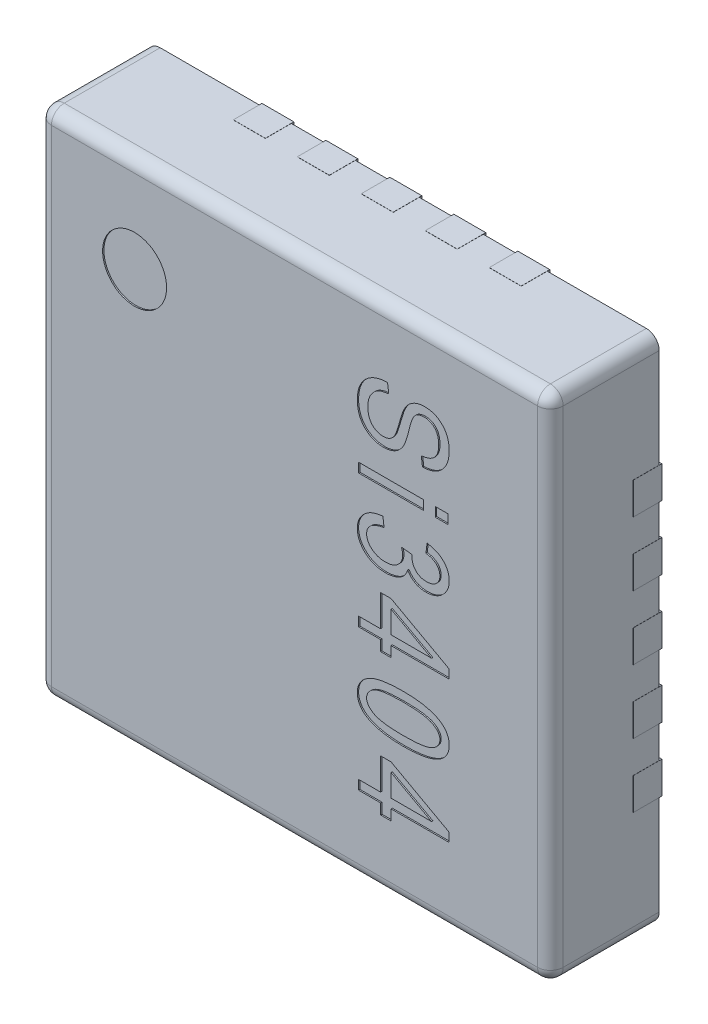
from build123d import *

# Parameters (mm, degrees)
SKETCH1_W                   = 4
SKETCH1_H                   = 4
BOSS_EXTRUDE1_DEPTH         = 0.85
FILLET1_R                   = 0.1
BOSS_EXTRUDE2_DEPTH         = 0.02
BOSS_EXTRUDE2_DEPTH_BACK    = 0.203
BOSS_EXTRUDE2_2_DEPTH       = 0.02
BOSS_EXTRUDE2_2_DEPTH_BACK  = 0.203
BOSS_EXTRUDE2_3_DEPTH       = 0.02
BOSS_EXTRUDE2_3_DEPTH_BACK  = 0.203
BOSS_EXTRUDE2_4_DEPTH       = 0.02
BOSS_EXTRUDE2_4_DEPTH_BACK  = 0.203
BOSS_EXTRUDE2_5_DEPTH       = 0.02
BOSS_EXTRUDE2_5_DEPTH_BACK  = 0.203
BOSS_EXTRUDE2_6_DEPTH       = 0.02
BOSS_EXTRUDE2_6_DEPTH_BACK  = 0.203
BOSS_EXTRUDE2_7_DEPTH       = 0.02
BOSS_EXTRUDE2_7_DEPTH_BACK  = 0.203
BOSS_EXTRUDE2_8_DEPTH       = 0.02
BOSS_EXTRUDE2_8_DEPTH_BACK  = 0.203
BOSS_EXTRUDE2_9_DEPTH       = 0.02
BOSS_EXTRUDE2_9_DEPTH_BACK  = 0.203
BOSS_EXTRUDE2_10_DEPTH      = 0.02
BOSS_EXTRUDE2_10_DEPTH_BACK = 0.203
BOSS_EXTRUDE2_11_DEPTH      = 0.02
BOSS_EXTRUDE2_11_DEPTH_BACK = 0.203
BOSS_EXTRUDE2_12_DEPTH      = 0.02
BOSS_EXTRUDE2_12_DEPTH_BACK = 0.203
BOSS_EXTRUDE2_13_DEPTH      = 0.02
BOSS_EXTRUDE2_13_DEPTH_BACK = 0.203
BOSS_EXTRUDE2_14_DEPTH      = 0.02
BOSS_EXTRUDE2_14_DEPTH_BACK = 0.203
BOSS_EXTRUDE2_15_DEPTH      = 0.02
BOSS_EXTRUDE2_15_DEPTH_BACK = 0.203
BOSS_EXTRUDE2_16_DEPTH      = 0.02
BOSS_EXTRUDE2_16_DEPTH_BACK = 0.203
BOSS_EXTRUDE2_17_DEPTH      = 0.02
BOSS_EXTRUDE2_17_DEPTH_BACK = 0.203
BOSS_EXTRUDE2_18_DEPTH      = 0.02
BOSS_EXTRUDE2_18_DEPTH_BACK = 0.203
BOSS_EXTRUDE2_19_DEPTH      = 0.02
BOSS_EXTRUDE2_19_DEPTH_BACK = 0.203
BOSS_EXTRUDE2_20_DEPTH      = 0.02
BOSS_EXTRUDE2_20_DEPTH_BACK = 0.203
BOSS_EXTRUDE2_21_DEPTH      = 0.02
BOSS_EXTRUDE2_21_DEPTH_BACK = 0.203
SKETCH3_R                   = 0.25
SKETCH3_W                   = 0.1
SKETCH3_H                   = 0.072727273
SKETCH3_W_2                 = 0.509090909
CUT_EXTRUDE1_DEPTH          = 0.01


with BuildPart() as part:
    # Sketch1 → Boss-Extrude1 (new body)
    with BuildSketch(Plane.XY):
        Rectangle(SKETCH1_W, SKETCH1_H)
    extrude(amount=BOSS_EXTRUDE1_DEPTH)

    # Fillet1
    fillet1_edges = [part.edges().sort_by_distance(p)[0] for p in [
        (2, 0, 0.85),
        (0, 2, 0.85),
        (-2, 0, 0.85),
        (-2, 2, 0.425),
        (2, 2, 0.425),
        (2, -2, 0.425),
        (-2, -2, 0.425),
        (0, -2, 0.85),
    ]]
    fillet(fillet1_edges, radius=FILLET1_R)

    # Sketch3 → Cut-Extrude1 (cut)
    # profile 1 of 8: a face of its own
    with BuildSketch(Plane.XY.offset(0.85)):
        with Locations((-1.25, 1.25)):
            Circle(SKETCH3_R)
    # profile 2 of 8: a face of its own
    with BuildSketch(Plane.XY.offset(0.85)):
        with BuildLine():
            Line((0.727272727, 1.472727273), (0.736363636, 1.4))
            add(Edge.make_bspline(
                [(0.736363636, 1.4), (0.727103806, 1.398942924), (0.709542466, 1.396938172), (0.684965563, 1.39141401), (0.663537943, 1.384126891), (0.645117837, 1.374788123), (0.629182151, 1.363372064), (0.615185549, 1.3498771), (0.602770645, 1.33423415), (0.591999182, 1.316678555), (0.583328643, 1.297412467), (0.577262693, 1.276760749), (0.573442789, 1.254970538), (0.572969302, 1.240025654), (0.572727273, 1.232386364)],
                knots=[0, 0, 0, 0, 1.280838358, 2.42911977, 3.45660717, 4.385483972, 5.258147535, 6.142272574, 7.050287598, 7.997198138, 8.967654339, 9.946114797, 10.950127382, 12, 12, 12, 12], degree=3))
            add(Edge.make_bspline(
                [(0.572727273, 1.232386364), (0.572837876, 1.226936735), (0.573052824, 1.216345826), (0.574673566, 1.200925091), (0.577105198, 1.186397183), (0.580934854, 1.172870183), (0.585305433, 1.160087678), (0.591259059, 1.148483936), (0.597935921, 1.137650827), (0.605728675, 1.127891958), (0.614419491, 1.11925579), (0.623697414, 1.111613117), (0.633690607, 1.105242101), (0.644221941, 1.099897755), (0.655475493, 1.095968576), (0.667240372, 1.092923818), (0.6797328, 1.091225755), (0.688252727, 1.0910163), (0.692613636, 1.090909091)],
                knots=[0, 0, 0, 0, 1.249746026, 2.428779581, 3.553697291, 4.62341608, 5.650607881, 6.646311833, 7.607599024, 8.56593672, 9.502864691, 10.4137476, 11.31754536, 12.216107463, 13.116177936, 14.046028929, 14.999863452, 16, 16, 16, 16], degree=3))
            add(Edge.make_bspline(
                [(0.692613636, 1.090909091), (0.697644535, 1.091061324), (0.707443503, 1.091357838), (0.721672501, 1.094004325), (0.734938598, 1.098209522), (0.747232571, 1.104246537), (0.758373301, 1.112183328), (0.768556469, 1.121755306), (0.777503341, 1.13317042), (0.784297687, 1.144047791), (0.789244318, 1.154559109), (0.793508689, 1.164489352), (0.798006744, 1.176448745), (0.802848127, 1.190417651), (0.807891789, 1.206400583), (0.813295911, 1.224406318), (0.819131335, 1.24437193), (0.822985269, 1.258422036), (0.825, 1.265767045)],
                knots=[0, 0, 0, 0, 1.005084549, 1.957660522, 2.882744275, 3.780292509, 4.683811859, 5.607974817, 6.5645409, 7.576069362, 8.164610543, 8.885578733, 9.73653607, 10.718528732, 11.841250066, 13.087129597, 14.477231467, 16, 16, 16, 16], degree=3))
            add(Edge.make_bspline(
                [(0.825, 1.265767045), (0.826860579, 1.272358405), (0.830446203, 1.285060972), (0.83617238, 1.303281471), (0.84178798, 1.320090385), (0.847619541, 1.335373731), (0.853368751, 1.349221368), (0.859379792, 1.361461672), (0.865313704, 1.372294413), (0.873175433, 1.384757779), (0.884183484, 1.398357259), (0.898826692, 1.412806622), (0.915198528, 1.425231004), (0.932987678, 1.435786634), (0.952232074, 1.444248055), (0.972880055, 1.450128526), (0.994693444, 1.454005862), (1.009689303, 1.454363329), (1.017329545, 1.454545455)],
                knots=[0, 0, 0, 0, 1.113986453, 2.146823571, 3.106424162, 3.996133152, 4.807195916, 5.544312915, 6.213079188, 6.815589384, 7.939013873, 9.050041172, 10.154508942, 11.273277387, 12.407970945, 13.56323151, 14.75849049, 16, 16, 16, 16], degree=3))
            add(Edge.make_bspline(
                [(1.017329545, 1.454545455), (1.024203666, 1.454388685), (1.037716801, 1.454080509), (1.057495016, 1.451449671), (1.076379214, 1.447279602), (1.0941677, 1.441057033), (1.111113818, 1.433444004), (1.126877432, 1.423802854), (1.141836305, 1.412654461), (1.155634887, 1.39974719), (1.168289632, 1.385530874), (1.179166448, 1.369842884), (1.188383474, 1.353014385), (1.196171029, 1.335041859), (1.201929476, 1.315760075), (1.205982817, 1.295352318), (1.2086464, 1.273791341), (1.208940216, 1.259004412), (1.209090909, 1.251420455)],
                knots=[0, 0, 0, 0, 1.048547399, 2.061232895, 3.039277619, 3.994368589, 4.931972946, 5.868741773, 6.808014961, 7.774272834, 8.746911737, 9.706990873, 10.680354074, 11.670809819, 12.690200298, 13.744432806, 14.843158913, 16, 16, 16, 16], degree=3))
            add(Edge.make_bspline(
                [(1.209090909, 1.251420455), (1.208802256, 1.241081), (1.208239018, 1.220906006), (1.203528429, 1.191640842), (1.195548121, 1.164387313), (1.184443342, 1.13924919), (1.170424466, 1.11642215), (1.153405846, 1.096299839), (1.133770421, 1.078738947), (1.111298043, 1.064152879), (1.086549759, 1.052265388), (1.059482045, 1.04389351), (1.030501444, 1.037956182), (1.010352719, 1.036904174), (1, 1.036363636)],
                knots=[0, 0, 0, 0, 1.103031712, 2.152304697, 3.153276159, 4.12609515, 5.076890607, 6.002136676, 6.929161205, 7.878034381, 8.852230514, 9.849470333, 10.895025311, 12, 12, 12, 12], degree=3))
            Line((1, 1.036363636), (0.990909091, 1.109090909))
            add(Edge.make_bspline(
                [(0.990909091, 1.109090909), (0.996506992, 1.109624065), (1.007423331, 1.110663761), (1.023124332, 1.113543253), (1.037773373, 1.117200429), (1.051226903, 1.121858913), (1.063610083, 1.12743429), (1.074823493, 1.133921291), (1.084918376, 1.141413119), (1.093882762, 1.149796571), (1.101795678, 1.159141799), (1.108591038, 1.169422163), (1.114476462, 1.180527397), (1.119117201, 1.192567714), (1.122861262, 1.205385125), (1.12534886, 1.219145774), (1.126938796, 1.233769534), (1.127159518, 1.24384034), (1.127272727, 1.249005682)],
                knots=[0, 0, 0, 0, 1.224838824, 2.388530277, 3.474573471, 4.512194328, 5.48648064, 6.429677658, 7.329378801, 8.219922745, 9.098431758, 9.991243998, 10.900419967, 11.831576646, 12.798129317, 13.805876065, 14.874628406, 16, 16, 16, 16], degree=3))
            add(Edge.make_bspline(
                [(1.127272727, 1.249005682), (1.127226084, 1.254266579), (1.127135928, 1.264435176), (1.125444538, 1.279184235), (1.123103586, 1.293016436), (1.11976564, 1.30593346), (1.115255117, 1.317815769), (1.110101268, 1.328881082), (1.103622453, 1.338808311), (1.096375843, 1.347845145), (1.08823977, 1.355757859), (1.079608307, 1.36274349), (1.070373617, 1.368660568), (1.060573076, 1.373513985), (1.050107793, 1.377177285), (1.039133042, 1.379918542), (1.027553436, 1.381467301), (1.019654026, 1.381699666), (1.015625, 1.381818182)],
                knots=[0, 0, 0, 0, 1.287208177, 2.487998315, 3.629583546, 4.720547933, 5.747622748, 6.737928225, 7.702594599, 8.642209589, 9.568501139, 10.475514979, 11.356601253, 12.248299753, 13.14660463, 14.065979384, 15.013569424, 16, 16, 16, 16], degree=3))
            add(Edge.make_bspline(
                [(1.015625, 1.381818182), (1.008402688, 1.381577201), (0.994669797, 1.381118986), (0.975324079, 1.376835154), (0.958367383, 1.369704713), (0.949112206, 1.362472858), (0.944602273, 1.358948864)],
                knots=[0, 0, 0, 0, 1.135097977, 2.158336086, 3.102579849, 4, 4, 4, 4], degree=3))
            add(Edge.make_bspline(
                [(0.944602273, 1.358948864), (0.942444624, 1.356785118), (0.937758322, 1.352085575), (0.931854076, 1.343034415), (0.925642614, 1.332260427), (0.920009033, 1.319203801), (0.914102065, 1.304340388), (0.908686505, 1.287294909), (0.90308319, 1.268283554), (0.899755702, 1.254797134), (0.898011364, 1.247727273)],
                knots=[0, 0, 0, 0, 0.600125557, 1.303441474, 2.117395318, 3.047759802, 4.098473224, 5.265768101, 6.566659033, 8, 8, 8, 8], degree=3))
            add(Edge.make_bspline(
                [(0.898011364, 1.247727273), (0.896331382, 1.240760861), (0.8931033, 1.22737491), (0.88805872, 1.208181265), (0.883442127, 1.190582405), (0.878896137, 1.174560658), (0.874367883, 1.160185683), (0.870057674, 1.147371638), (0.866242523, 1.136092542), (0.863298459, 1.129292811), (0.861931818, 1.126136364)],
                knots=[0, 0, 0, 0, 1.354602698, 2.602867115, 3.751358272, 4.793927027, 5.750750683, 6.599868674, 7.350056397, 8, 8, 8, 8], degree=3))
            add(Edge.make_bspline(
                [(0.861931818, 1.126136364), (0.857794116, 1.11768145), (0.849737463, 1.101218618), (0.834281395, 1.079105556), (0.816284253, 1.060415276), (0.796132303, 1.044889628), (0.773672126, 1.032819649), (0.749121081, 1.024326376), (0.722569969, 1.019082478), (0.704191573, 1.018487607), (0.694744318, 1.018181818)],
                knots=[0, 0, 0, 0, 1.065654875, 2.074970594, 3.042706323, 3.995751283, 4.946482197, 5.918907631, 6.930232564, 8, 8, 8, 8], degree=3))
            add(Edge.make_bspline(
                [(0.694744318, 1.018181818), (0.685250511, 1.018491935), (0.666491623, 1.019104699), (0.639041754, 1.024505651), (0.612945604, 1.033414689), (0.588377235, 1.04555853), (0.566016439, 1.060935426), (0.546002634, 1.078726398), (0.529084761, 1.09933212), (0.515104263, 1.122387409), (0.504014348, 1.147919092), (0.496540716, 1.176029999), (0.491702396, 1.206509198), (0.491179657, 1.227679024), (0.490909091, 1.238636364)],
                knots=[0, 0, 0, 0, 1.011232613, 1.998102583, 2.968509142, 3.943590051, 4.909523818, 5.853018554, 6.788746208, 7.740024944, 8.71886049, 9.744946948, 10.832801918, 12, 12, 12, 12], degree=3))
            add(Edge.make_bspline(
                [(0.490909091, 1.238636364), (0.491090569, 1.247262596), (0.4914447, 1.264095561), (0.494475914, 1.288630632), (0.49945995, 1.31183118), (0.506331363, 1.333720101), (0.515422896, 1.354247791), (0.52633162, 1.373488906), (0.539345312, 1.391353972), (0.554307753, 1.407684438), (0.570914055, 1.422445694), (0.58901038, 1.435475574), (0.608703269, 1.446421701), (0.629629785, 1.455701381), (0.652108127, 1.462753199), (0.675840059, 1.468189337), (0.701091851, 1.47159385), (0.718408483, 1.472343522), (0.727272727, 1.472727273)],
                knots=[0, 0, 0, 0, 1.104941531, 2.156148984, 3.161617203, 4.142029089, 5.090015186, 6.032862687, 6.970857379, 7.915576694, 8.8652501, 9.813080891, 10.76648675, 11.747123846, 12.740939458, 13.779962465, 14.863580683, 16, 16, 16, 16], degree=3))
        make_face()
    # profile 3 of 8: a face of its own
    with BuildSketch(Plane.XY.offset(0.85)):
        with Locations((1.15, 0.783636364)):
            Rectangle(SKETCH3_W, SKETCH3_H)
    # profile 4 of 8: a face of its own
    with BuildSketch(Plane.XY.offset(0.85)):
        with Locations((0.754545454, 0.783636364)):
            Rectangle(SKETCH3_W_2, SKETCH3_H)
    # profile 5 of 8: a face of its own
    with BuildSketch(Plane.XY.offset(0.85)):
        with BuildLine():
            Line((0.690909091, 0.549090909), (0.7, 0.476363636))
            add(Edge.make_bspline(
                [(0.7, 0.476363636), (0.694496447, 0.475425654), (0.683772037, 0.473597868), (0.668339154, 0.470001597), (0.653897987, 0.466076607), (0.640584485, 0.461527455), (0.628268604, 0.456568748), (0.617028874, 0.451069876), (0.606867177, 0.444921933), (0.597777622, 0.438276249), (0.589717165, 0.431112297), (0.582738606, 0.423462665), (0.576846937, 0.415255713), (0.571943811, 0.406569672), (0.568306467, 0.397267088), (0.565530449, 0.387530742), (0.563986474, 0.377217575), (0.563754763, 0.370165795), (0.563636364, 0.3665625)],
                knots=[0, 0, 0, 0, 1.392235382, 2.712957193, 3.95076201, 5.123471921, 6.220028287, 7.260520794, 8.240826993, 9.178593426, 10.065213643, 10.926376853, 11.755607984, 12.580369742, 13.407158359, 14.241002189, 15.101193065, 16, 16, 16, 16], degree=3))
            add(Edge.make_bspline(
                [(0.563636364, 0.3665625), (0.563711161, 0.362621302), (0.563858176, 0.354874811), (0.56605663, 0.343524847), (0.569043998, 0.332489868), (0.573768787, 0.32196), (0.579362749, 0.311681696), (0.586480905, 0.301903465), (0.594881855, 0.292609707), (0.604305986, 0.283673975), (0.614831196, 0.275597424), (0.626184798, 0.268479206), (0.63838825, 0.262489276), (0.651268652, 0.257539143), (0.664906815, 0.253657817), (0.679269095, 0.250999418), (0.69442538, 0.249432784), (0.704778432, 0.249206763), (0.710085227, 0.249090909)],
                knots=[0, 0, 0, 0, 0.903873886, 1.776579465, 2.647656607, 3.524622446, 4.420541798, 5.332235935, 6.29517969, 7.295547799, 8.311582909, 9.337756895, 10.369048988, 11.429583737, 12.503863447, 13.621753468, 14.780951969, 16, 16, 16, 16], degree=3))
            add(Edge.make_bspline(
                [(0.710085227, 0.249090909), (0.715059778, 0.24921972), (0.724745068, 0.24947051), (0.738911993, 0.250849894), (0.752333767, 0.253377255), (0.764973724, 0.25715351), (0.777026588, 0.261625291), (0.788246195, 0.267333195), (0.798697065, 0.274068739), (0.808303906, 0.281689386), (0.816965072, 0.290101324), (0.824663003, 0.298978616), (0.831123294, 0.30847327), (0.836393044, 0.318374065), (0.84038126, 0.328797836), (0.843422805, 0.339570243), (0.845135603, 0.350930042), (0.845346853, 0.358649804), (0.845454545, 0.362585227)],
                knots=[0, 0, 0, 0, 1.20855087, 2.353009927, 3.453810045, 4.520244562, 5.554115699, 6.572581516, 7.571175158, 8.569901267, 9.54598548, 10.500346522, 11.419112918, 12.329780476, 13.2183167, 14.125199497, 15.044253818, 16, 16, 16, 16], degree=3))
            add(Edge.make_bspline(
                [(0.845454545, 0.362585227), (0.845342557, 0.366143633), (0.84510383, 0.373729176), (0.843039294, 0.385673693), (0.840137612, 0.398892547), (0.837290224, 0.407964726), (0.835795455, 0.412727273)],
                knots=[0, 0, 0, 0, 0.832645691, 1.774971563, 2.831945141, 4, 4, 4, 4], degree=3))
            Line((0.835795455, 0.412727273), (0.918181818, 0.403636364))
            Line((0.918181818, 0.403636364), (0.9171875, 0.392698864))
            add(Edge.make_bspline(
                [(0.9171875, 0.392698864), (0.917235164, 0.388478025), (0.917328173, 0.380241741), (0.919057124, 0.36819763), (0.921333634, 0.356702359), (0.924854559, 0.345858881), (0.928994, 0.335516706), (0.934580986, 0.325992241), (0.940734723, 0.316839029), (0.948011564, 0.308479316), (0.95609207, 0.300937143), (0.964933076, 0.294403563), (0.97435578, 0.288830586), (0.984392716, 0.28423291), (0.995113871, 0.280695991), (1.006476653, 0.278117888), (1.018527392, 0.276746863), (1.026748786, 0.276493565), (1.030965909, 0.276363636)],
                knots=[0, 0, 0, 0, 1.10423394, 2.154733732, 3.181022991, 4.16930239, 5.136508654, 6.091636863, 7.054700897, 8.021748173, 8.986885544, 9.944184593, 10.894794516, 11.849198014, 12.829510438, 13.846317023, 14.895278801, 16, 16, 16, 16], degree=3))
            add(Edge.make_bspline(
                [(1.030965909, 0.276363636), (1.038519893, 0.276689599), (1.053037298, 0.277316041), (1.073714316, 0.282124701), (1.092016699, 0.290504008), (1.107664797, 0.302039188), (1.120274673, 0.315920296), (1.129724418, 0.331427137), (1.135323413, 0.348624699), (1.13601263, 0.360603788), (1.136363636, 0.366704545)],
                knots=[0, 0, 0, 0, 1.168747258, 2.246123166, 3.262822778, 4.26410748, 5.234436762, 6.148309006, 7.056963545, 8, 8, 8, 8], degree=3))
            add(Edge.make_bspline(
                [(1.136363636, 0.366704545), (1.136060916, 0.373041031), (1.135469846, 0.385413186), (1.130093975, 0.403086684), (1.121595553, 0.419253501), (1.111572285, 0.431062772), (1.102024598, 0.439436614), (1.093992138, 0.445366184), (1.085004348, 0.450566116), (1.075195558, 0.455276144), (1.064455651, 0.459289673), (1.052806874, 0.462395198), (1.040388866, 0.465400259), (1.031737328, 0.466635358), (1.027272727, 0.467272727)],
                knots=[0, 0, 0, 0, 1.389005371, 2.712069755, 4.019587974, 5.377996234, 6.085444253, 6.807349242, 7.567292217, 8.362846198, 9.195542922, 10.081373278, 11.009898347, 12, 12, 12, 12], degree=3))
            Line((1.027272727, 0.467272727), (1.036363636, 0.54))
            add(Edge.make_bspline(
                [(1.036363636, 0.54), (1.04329227, 0.538803439), (1.056807965, 0.536469307), (1.076302893, 0.531691282), (1.094378863, 0.525637773), (1.111265512, 0.518898159), (1.126836703, 0.51093557), (1.14101069, 0.501777111), (1.154120744, 0.491900053), (1.165542045, 0.480704911), (1.175872255, 0.468955498), (1.18465392, 0.456362674), (1.192267472, 0.44329184), (1.198391803, 0.429510989), (1.203250555, 0.415161579), (1.206650067, 0.400168529), (1.20865989, 0.384609754), (1.208945862, 0.374049456), (1.209090909, 0.368693182)],
                knots=[0, 0, 0, 0, 1.259944731, 2.457775895, 3.592886089, 4.673894175, 5.713785687, 6.721284142, 7.69553461, 8.649770748, 9.582174566, 10.495658022, 11.396640192, 12.289271576, 13.19360432, 14.107600028, 15.040158295, 16, 16, 16, 16], degree=3))
            add(Edge.make_bspline(
                [(1.209090909, 0.368693182), (1.208924431, 0.363049413), (1.208596911, 0.35194616), (1.206083875, 0.335626703), (1.202166886, 0.319931836), (1.196456157, 0.304903342), (1.188933749, 0.290674804), (1.180112756, 0.276895741), (1.169544157, 0.263798487), (1.157400619, 0.251588309), (1.144112167, 0.240380457), (1.129834452, 0.230549972), (1.114808516, 0.222106469), (1.09881669, 0.215401742), (1.08202042, 0.210161077), (1.064392392, 0.206331518), (1.045896839, 0.203986532), (1.033293043, 0.203754858), (1.026846591, 0.203636364)],
                knots=[0, 0, 0, 0, 0.987546189, 1.94284647, 2.883618689, 3.814886987, 4.749064414, 5.696240478, 6.674807358, 7.688712876, 8.706405422, 9.713376545, 10.718845743, 11.717906576, 12.742863162, 13.794678478, 14.872046121, 16, 16, 16, 16], degree=3))
            add(Edge.make_bspline(
                [(1.026846591, 0.203636364), (1.019061538, 0.203851029), (1.003857444, 0.204270268), (0.981837279, 0.208444501), (0.961100431, 0.214765371), (0.941891577, 0.22390113), (0.924390098, 0.235433359), (0.908784471, 0.249054631), (0.895002505, 0.264639823), (0.887757171, 0.276480172), (0.884090909, 0.282471591)],
                knots=[0, 0, 0, 0, 1.089886849, 2.128533029, 3.129639471, 4.121022339, 5.098291878, 6.057736824, 7.017181769, 8, 8, 8, 8], degree=3))
            add(Edge.make_bspline(
                [(0.884090909, 0.282471591), (0.88239733, 0.276967365), (0.879088293, 0.266212805), (0.871636343, 0.251376358), (0.862982911, 0.237846985), (0.852601278, 0.225762137), (0.840498109, 0.214999009), (0.82653073, 0.205434625), (0.810743952, 0.196981439), (0.793269278, 0.189591128), (0.774340433, 0.183678093), (0.754177183, 0.179433482), (0.73292851, 0.176824058), (0.718378843, 0.176519435), (0.7109375, 0.176363636)],
                knots=[0, 0, 0, 0, 0.945030563, 1.846469783, 2.718540466, 3.579533124, 4.455899065, 5.373354321, 6.355314578, 7.394566758, 8.487420881, 9.609289398, 10.777284816, 12, 12, 12, 12], degree=3))
            add(Edge.make_bspline(
                [(0.7109375, 0.176363636), (0.703021326, 0.176502939), (0.687566503, 0.176774901), (0.664914424, 0.179618992), (0.643369356, 0.183923338), (0.622854283, 0.190063416), (0.603527923, 0.197997787), (0.585279751, 0.20779619), (0.568107878, 0.219251999), (0.552253147, 0.232441509), (0.538057615, 0.24686346), (0.52537201, 0.261976014), (0.514729806, 0.277893273), (0.505937928, 0.294479669), (0.499261751, 0.311809386), (0.494382501, 0.32978969), (0.491500664, 0.348524606), (0.491108066, 0.361249634), (0.490909091, 0.367698864)],
                knots=[0, 0, 0, 0, 1.16797173, 2.280242353, 3.364490462, 4.408173669, 5.436152277, 6.443028727, 7.460738993, 8.478233232, 9.481512989, 10.444418881, 11.386528098, 12.302557467, 13.209825675, 14.12198051, 15.04819242, 16, 16, 16, 16], degree=3))
            add(Edge.make_bspline(
                [(0.490909091, 0.367698864), (0.49106688, 0.373674346), (0.49137769, 0.385444768), (0.494017487, 0.402725824), (0.498254167, 0.419307912), (0.504296682, 0.435128668), (0.511852937, 0.450372889), (0.521261599, 0.46480431), (0.532344745, 0.478602567), (0.54502664, 0.491568042), (0.559222815, 0.50341595), (0.574527637, 0.514177241), (0.591021863, 0.523629453), (0.608866953, 0.531323557), (0.627705952, 0.537907933), (0.647689015, 0.543173853), (0.668872363, 0.547035575), (0.683461471, 0.54839628), (0.690909091, 0.549090909)],
                knots=[0, 0, 0, 0, 0.959274814, 1.889566238, 2.800731978, 3.703256649, 4.604498869, 5.528396462, 6.464265966, 7.442996794, 8.436156864, 9.429840861, 10.444772988, 11.483305447, 12.546329121, 13.647537524, 14.799087218, 16, 16, 16, 16], degree=3))
        make_face()
    # profile 6 of 8: a face of its own
    with BuildSketch(Plane.XY.offset(0.85)):
        Polygon((0.5, -0.221818182), (0.672727273, -0.221818182), (0.672727273, 0.023636364), (0.754545455, 0.023636364), (1.209090909, -0.2259375), (1.209090909, -0.294545455), (0.754545455, -0.294545455), (0.754545455, -0.376363636), (0.672727273, -0.376363636), (0.672727273, -0.294545455), (0.5, -0.294545455), align=None)
        Polygon((0.754545455, -0.221818182), (1.070880682, -0.221818182), (0.754545455, -0.048096591), align=None, mode=Mode.SUBTRACT)
    # profile 7 of 8: a face of its own
    with BuildSketch(Plane.XY.offset(0.85)):
        with BuildLine():
            add(Edge.make_bspline(
                [(0.849715909, -0.556363636), (0.864018406, -0.556479125), (0.891790416, -0.556703376), (0.932070571, -0.55902096), (0.969701185, -0.562676476), (1.004631799, -0.567647485), (1.036867658, -0.574375159), (1.066460479, -0.582297668), (1.093316153, -0.59202809), (1.117549837, -0.602980279), (1.139026216, -0.615539923), (1.157819091, -0.629386398), (1.173623453, -0.644930442), (1.186765395, -0.661743447), (1.196777255, -0.680159886), (1.203972575, -0.699917633), (1.208314524, -0.721089729), (1.208828608, -0.735699215), (1.209090909, -0.743153409)],
                knots=[0, 0, 0, 0, 1.522295809, 2.955932353, 4.292935845, 5.545987552, 6.709403679, 7.796379217, 8.803980711, 9.746667296, 10.623167879, 11.447716403, 12.224665142, 12.975696349, 13.710987297, 14.4460191, 15.207112772, 16, 16, 16, 16], degree=3))
            add(Edge.make_bspline(
                [(1.209090909, -0.743153409), (1.20887781, -0.749796287), (1.208459332, -0.762841378), (1.205008326, -0.781877465), (1.199137357, -0.799782136), (1.19097846, -0.816568913), (1.180444589, -0.832186805), (1.167707824, -0.846789472), (1.152511366, -0.860216893), (1.141095253, -0.867992109), (1.135227273, -0.871988636)],
                knots=[0, 0, 0, 0, 1.02435884, 2.0116063, 2.972586715, 3.92329494, 4.881606269, 5.870473939, 6.905405214, 8, 8, 8, 8], degree=3))
            add(Edge.make_bspline(
                [(1.135227273, -0.871988636), (1.127316116, -0.876615674), (1.11086403, -0.886238087), (1.083294617, -0.897709313), (1.052531649, -0.907457789), (1.018360552, -0.915330546), (0.980918981, -0.921463418), (0.940148389, -0.925980635), (0.896059427, -0.928675406), (0.865534238, -0.928949086), (0.849715909, -0.929090909)],
                knots=[0, 0, 0, 0, 0.745771411, 1.550910329, 2.425371873, 3.372025496, 4.40417091, 5.51399708, 6.711738941, 8, 8, 8, 8], degree=3))
            add(Edge.make_bspline(
                [(0.849715909, -0.929090909), (0.835507837, -0.928977261), (0.807924554, -0.928756628), (0.767837464, -0.926409842), (0.730385451, -0.922823762), (0.695585166, -0.917716823), (0.66338928, -0.911289648), (0.633825258, -0.903207292), (0.60682359, -0.893793419), (0.582584972, -0.882689426), (0.56099335, -0.870304945), (0.542330059, -0.85623908), (0.526341998, -0.840919877), (0.513432235, -0.823895706), (0.503145474, -0.805596204), (0.496069148, -0.785707642), (0.491666966, -0.764464331), (0.491165663, -0.74980429), (0.490909091, -0.742301136)],
                knots=[0, 0, 0, 0, 1.513638993, 2.938550056, 4.276810647, 5.521058184, 6.684551525, 7.772549076, 8.784146649, 9.727719582, 10.609399212, 11.430689058, 12.211976068, 12.960643328, 13.699059428, 14.439523366, 15.201332645, 16, 16, 16, 16], degree=3))
            add(Edge.make_bspline(
                [(0.490909091, -0.742301136), (0.491162431, -0.735609705), (0.491660525, -0.722453599), (0.495376062, -0.703179682), (0.501955149, -0.684952438), (0.510728093, -0.667560122), (0.522162205, -0.651128811), (0.536188865, -0.635806575), (0.552725131, -0.621410102), (0.571741257, -0.60773654), (0.594010355, -0.595464798), (0.619825815, -0.584820438), (0.649307759, -0.576020801), (0.682379244, -0.568888213), (0.719048485, -0.563263645), (0.759346303, -0.559219079), (0.803333109, -0.556843926), (0.833851137, -0.556527915), (0.849715909, -0.556363636)],
                knots=[0, 0, 0, 0, 0.713869728, 1.403548212, 2.084322439, 2.775775399, 3.476561715, 4.213413713, 4.986745763, 5.812567673, 6.708194186, 7.693455774, 8.786715548, 9.986913065, 11.301071208, 12.743477975, 14.307099656, 16, 16, 16, 16], degree=3))
        make_face()
        with BuildLine():
            add(Edge.make_bspline(
                [(0.85, -0.629090909), (0.836362661, -0.629217723), (0.810311295, -0.629459976), (0.77292721, -0.630791294), (0.739094522, -0.633307616), (0.708706628, -0.63680253), (0.681889051, -0.641233506), (0.658494143, -0.646702351), (0.638617029, -0.653219015), (0.621974698, -0.660885872), (0.608159425, -0.669387885), (0.596387179, -0.678469132), (0.586177505, -0.687858857), (0.578022047, -0.698123104), (0.571427784, -0.708779322), (0.567125013, -0.720239285), (0.564019303, -0.732098757), (0.56376491, -0.740291823), (0.563636364, -0.744431818)],
                knots=[0, 0, 0, 0, 1.930873368, 3.688541263, 5.295281011, 6.732986767, 8.018032389, 9.141589856, 10.131594649, 10.974379403, 11.729767228, 12.422984227, 13.077418253, 13.687793181, 14.274134012, 14.843047171, 15.415386244, 16, 16, 16, 16], degree=3))
            add(Edge.make_bspline(
                [(0.563636364, -0.744431818), (0.563770469, -0.748334839), (0.564037495, -0.756106375), (0.56712155, -0.767426794), (0.571576613, -0.778335497), (0.578242766, -0.788564528), (0.586481958, -0.798407174), (0.59674323, -0.807646215), (0.608728965, -0.816446489), (0.62275552, -0.82487131), (0.639480638, -0.832460827), (0.659454862, -0.838898202), (0.682824239, -0.844391083), (0.709671875, -0.848586628), (0.739896521, -0.852158998), (0.773543049, -0.854664227), (0.810642566, -0.855991303), (0.836504655, -0.856235966), (0.85, -0.856363636)],
                knots=[0, 0, 0, 0, 0.556129238, 1.107341817, 1.665113981, 2.233690862, 2.843387872, 3.494489121, 4.200669471, 4.965119033, 5.82775868, 6.818098825, 7.958326279, 9.253800823, 10.697700866, 12.3053812, 14.072075553, 16, 16, 16, 16], degree=3))
            add(Edge.make_bspline(
                [(0.85, -0.856363636), (0.863637177, -0.856234223), (0.889782858, -0.855986107), (0.927216399, -0.854683438), (0.961139016, -0.852121461), (0.991489174, -0.84868837), (1.018336074, -0.844172492), (1.041714521, -0.838811862), (1.061552033, -0.832188944), (1.07815998, -0.82463007), (1.091856103, -0.815957837), (1.103794543, -0.807091007), (1.113820502, -0.797390549), (1.121960114, -0.787077589), (1.128558822, -0.776323559), (1.133121808, -0.764797496), (1.135910194, -0.752662), (1.136211854, -0.74435179), (1.136363636, -0.740170455)],
                knots=[0, 0, 0, 0, 1.926235416, 3.693047084, 5.289258742, 6.730153421, 8.005519028, 9.13288288, 10.114172052, 10.95493244, 11.702816375, 12.399683393, 13.05233992, 13.666478021, 14.251410463, 14.827637953, 15.41011848, 16, 16, 16, 16], degree=3))
            add(Edge.make_bspline(
                [(1.136363636, -0.740170455), (1.136230178, -0.736268289), (1.135966015, -0.728544448), (1.132923378, -0.717338537), (1.128292912, -0.706620872), (1.121866227, -0.696298625), (1.113342797, -0.686678503), (1.103125353, -0.677507772), (1.091082771, -0.668877887), (1.077136341, -0.660479745), (1.060475749, -0.652755727), (1.040407591, -0.646631592), (1.017070851, -0.641106317), (0.990308625, -0.636617522), (0.960088627, -0.633372173), (0.926459862, -0.630766541), (0.889356597, -0.629470078), (0.863495058, -0.629220923), (0.85, -0.629090909)],
                knots=[0, 0, 0, 0, 0.557198885, 1.102904464, 1.649282923, 2.224688945, 2.83480633, 3.482602988, 4.186138189, 4.952058077, 5.810197453, 6.806783836, 7.949204379, 9.241603339, 10.687502539, 12.29827505, 14.068367425, 16, 16, 16, 16], degree=3))
        make_face(mode=Mode.SUBTRACT)
    # profile 8 of 8: a face of its own
    with BuildSketch(Plane.XY.offset(0.85)):
        Polygon((0.5, -1.327272727), (0.672727273, -1.327272727), (0.672727273, -1.081818182), (0.754545455, -1.081818182), (1.209090909, -1.331392045), (1.209090909, -1.4), (0.754545455, -1.4), (0.754545455, -1.481818182), (0.672727273, -1.481818182), (0.672727273, -1.4), (0.5, -1.4), align=None)
        Polygon((0.754545455, -1.327272727), (1.070880682, -1.327272727), (0.754545455, -1.153551136), align=None, mode=Mode.SUBTRACT)
    extrude(amount=-CUT_EXTRUDE1_DEPTH, mode=Mode.SUBTRACT)


with BuildPart() as body_2:
    # Sketch2 → Boss-Extrude2 (new, two sides: drawn at the far end of the back side and taken through both)
    with BuildSketch(Plane(origin=(0, 0, 0), x_dir=(-1, 0, 0), z_dir=(0, 0, -1)).offset(-BOSS_EXTRUDE2_DEPTH_BACK)):
        with BuildLine():
            Line((1.263388348, 1.036611652), (1.036611652, 1.263388348))
            ThreePointArc((1.036611652, 1.263388348), (0.996058734, 1.290484942), (0.948223305, 1.3))
            Line((0.948223305, 1.3), (-1.175, 1.3))
            ThreePointArc((-1.175, 1.3), (-1.263388348, 1.263388348), (-1.3, 1.175))
            Line((-1.3, 1.175), (-1.3, -1.175))
            ThreePointArc((-1.3, -1.175), (-1.263388348, -1.263388348), (-1.175, -1.3))
            Line((-1.175, -1.3), (1.175, -1.3))
            ThreePointArc((1.175, -1.3), (1.263388348, -1.263388348), (1.3, -1.175))
            Line((1.3, -1.175), (1.3, 0.948223305))
            ThreePointArc((1.3, 0.948223305), (1.290484942, 0.996058734), (1.263388348, 1.036611652))
        make_face()
    extrude(amount=BOSS_EXTRUDE2_DEPTH + BOSS_EXTRUDE2_DEPTH_BACK)


with BuildPart() as body_3:
    # Sketch2 → Boss-Extrude2 2 (new, two sides: drawn at the far end of the back side and taken through both)
    with BuildSketch(Plane(origin=(0, 0, 0), x_dir=(-1, 0, 0), z_dir=(0, 0, -1)).offset(-BOSS_EXTRUDE2_2_DEPTH_BACK)):
        with BuildLine():
            Line((-0.125, 2.001), (0.125, 2.001))
            Line((0.125, 2.001), (0.125, 1.726))
            ThreePointArc((0.125, 1.726), (0, 1.601), (-0.125, 1.726))
            Line((-0.125, 1.726), (-0.125, 2.001))
        make_face()
    extrude(amount=BOSS_EXTRUDE2_2_DEPTH + BOSS_EXTRUDE2_2_DEPTH_BACK)


with BuildPart() as body_4:
    # Sketch2 → Boss-Extrude2 3 (new, two sides: drawn at the far end of the back side and taken through both)
    with BuildSketch(Plane(origin=(0, 0, 0), x_dir=(-1, 0, 0), z_dir=(0, 0, -1)).offset(-BOSS_EXTRUDE2_3_DEPTH_BACK)):
        with BuildLine():
            Line((-0.375, 2.001), (-0.375, 1.726))
            ThreePointArc((-0.375, 1.726), (-0.5, 1.601), (-0.625, 1.726))
            Line((-0.625, 1.726), (-0.625, 2.001))
            Line((-0.625, 2.001), (-0.375, 2.001))
        make_face()
    extrude(amount=BOSS_EXTRUDE2_3_DEPTH + BOSS_EXTRUDE2_3_DEPTH_BACK)


with BuildPart() as body_5:
    # Sketch2 → Boss-Extrude2 4 (new, two sides: drawn at the far end of the back side and taken through both)
    with BuildSketch(Plane(origin=(0, 0, 0), x_dir=(-1, 0, 0), z_dir=(0, 0, -1)).offset(-BOSS_EXTRUDE2_4_DEPTH_BACK)):
        with BuildLine():
            Line((-0.875, 2.001), (-0.875, 1.726))
            ThreePointArc((-0.875, 1.726), (-1, 1.601), (-1.125, 1.726))
            Line((-1.125, 1.726), (-1.125, 2.001))
            Line((-1.125, 2.001), (-0.875, 2.001))
        make_face()
    extrude(amount=BOSS_EXTRUDE2_4_DEPTH + BOSS_EXTRUDE2_4_DEPTH_BACK)


with BuildPart() as body_6:
    # Sketch2 → Boss-Extrude2 5 (new, two sides: drawn at the far end of the back side and taken through both)
    with BuildSketch(Plane(origin=(0, 0, 0), x_dir=(-1, 0, 0), z_dir=(0, 0, -1)).offset(-BOSS_EXTRUDE2_5_DEPTH_BACK)):
        with BuildLine():
            Line((1.125, 2.001), (0.875, 2.001))
            Line((0.875, 2.001), (0.875, 1.726))
            ThreePointArc((0.875, 1.726), (1, 1.601), (1.125, 1.726))
            Line((1.125, 1.726), (1.125, 2.001))
        make_face()
    extrude(amount=BOSS_EXTRUDE2_5_DEPTH + BOSS_EXTRUDE2_5_DEPTH_BACK)


with BuildPart() as body_7:
    # Sketch2 → Boss-Extrude2 6 (new, two sides: drawn at the far end of the back side and taken through both)
    with BuildSketch(Plane(origin=(0, 0, 0), x_dir=(-1, 0, 0), z_dir=(0, 0, -1)).offset(-BOSS_EXTRUDE2_6_DEPTH_BACK)):
        with BuildLine():
            Line((0.625, 2.001), (0.375, 2.001))
            Line((0.375, 2.001), (0.375, 1.726))
            ThreePointArc((0.375, 1.726), (0.5, 1.601), (0.625, 1.726))
            Line((0.625, 1.726), (0.625, 2.001))
        make_face()
    extrude(amount=BOSS_EXTRUDE2_6_DEPTH + BOSS_EXTRUDE2_6_DEPTH_BACK)


with BuildPart() as body_8:
    # Sketch2 → Boss-Extrude2 7 (new, two sides: drawn at the far end of the back side and taken through both)
    with BuildSketch(Plane(origin=(0, 0, 0), x_dir=(-1, 0, 0), z_dir=(0, 0, -1)).offset(-BOSS_EXTRUDE2_7_DEPTH_BACK)):
        with BuildLine():
            Line((1.125, -2.001), (1.125, -1.726))
            ThreePointArc((1.125, -1.726), (1, -1.601), (0.875, -1.726))
            Line((0.875, -1.726), (0.875, -2.001))
            Line((0.875, -2.001), (1.125, -2.001))
        make_face()
    extrude(amount=BOSS_EXTRUDE2_7_DEPTH + BOSS_EXTRUDE2_7_DEPTH_BACK)


with BuildPart() as body_9:
    # Sketch2 → Boss-Extrude2 8 (new, two sides: drawn at the far end of the back side and taken through both)
    with BuildSketch(Plane(origin=(0, 0, 0), x_dir=(-1, 0, 0), z_dir=(0, 0, -1)).offset(-BOSS_EXTRUDE2_8_DEPTH_BACK)):
        with BuildLine():
            Line((0.625, -2.001), (0.625, -1.726))
            ThreePointArc((0.625, -1.726), (0.5, -1.601), (0.375, -1.726))
            Line((0.375, -1.726), (0.375, -2.001))
            Line((0.375, -2.001), (0.625, -2.001))
        make_face()
    extrude(amount=BOSS_EXTRUDE2_8_DEPTH + BOSS_EXTRUDE2_8_DEPTH_BACK)


with BuildPart() as body_10:
    # Sketch2 → Boss-Extrude2 9 (new, two sides: drawn at the far end of the back side and taken through both)
    with BuildSketch(Plane(origin=(0, 0, 0), x_dir=(-1, 0, 0), z_dir=(0, 0, -1)).offset(-BOSS_EXTRUDE2_9_DEPTH_BACK)):
        with BuildLine():
            Line((-0.125, -2.001), (0.125, -2.001))
            Line((0.125, -2.001), (0.125, -1.726))
            ThreePointArc((0.125, -1.726), (0, -1.601), (-0.125, -1.726))
            Line((-0.125, -1.726), (-0.125, -2.001))
        make_face()
    extrude(amount=BOSS_EXTRUDE2_9_DEPTH + BOSS_EXTRUDE2_9_DEPTH_BACK)


with BuildPart() as body_11:
    # Sketch2 → Boss-Extrude2 10 (new, two sides: drawn at the far end of the back side and taken through both)
    with BuildSketch(Plane(origin=(0, 0, 0), x_dir=(-1, 0, 0), z_dir=(0, 0, -1)).offset(-BOSS_EXTRUDE2_10_DEPTH_BACK)):
        with BuildLine():
            Line((-0.625, -2.001), (-0.375, -2.001))
            Line((-0.375, -2.001), (-0.375, -1.726))
            ThreePointArc((-0.375, -1.726), (-0.5, -1.601), (-0.625, -1.726))
            Line((-0.625, -1.726), (-0.625, -2.001))
        make_face()
    extrude(amount=BOSS_EXTRUDE2_10_DEPTH + BOSS_EXTRUDE2_10_DEPTH_BACK)


with BuildPart() as body_12:
    # Sketch2 → Boss-Extrude2 11 (new, two sides: drawn at the far end of the back side and taken through both)
    with BuildSketch(Plane(origin=(0, 0, 0), x_dir=(-1, 0, 0), z_dir=(0, 0, -1)).offset(-BOSS_EXTRUDE2_11_DEPTH_BACK)):
        with BuildLine():
            Line((-1.125, -2.001), (-0.875, -2.001))
            Line((-0.875, -2.001), (-0.875, -1.726))
            ThreePointArc((-0.875, -1.726), (-1, -1.601), (-1.125, -1.726))
            Line((-1.125, -1.726), (-1.125, -2.001))
        make_face()
    extrude(amount=BOSS_EXTRUDE2_11_DEPTH + BOSS_EXTRUDE2_11_DEPTH_BACK)


with BuildPart() as body_13:
    # Sketch2 → Boss-Extrude2 12 (new, two sides: drawn at the far end of the back side and taken through both)
    with BuildSketch(Plane(origin=(0, 0, 0), x_dir=(-1, 0, 0), z_dir=(0, 0, -1)).offset(-BOSS_EXTRUDE2_12_DEPTH_BACK)):
        with BuildLine():
            Line((2.001, -1.125), (2.001, -0.875))
            Line((2.001, -0.875), (1.726, -0.875))
            ThreePointArc((1.726, -0.875), (1.601, -1), (1.726, -1.125))
            Line((1.726, -1.125), (2.001, -1.125))
        make_face()
    extrude(amount=BOSS_EXTRUDE2_12_DEPTH + BOSS_EXTRUDE2_12_DEPTH_BACK)


with BuildPart() as body_14:
    # Sketch2 → Boss-Extrude2 13 (new, two sides: drawn at the far end of the back side and taken through both)
    with BuildSketch(Plane(origin=(0, 0, 0), x_dir=(-1, 0, 0), z_dir=(0, 0, -1)).offset(-BOSS_EXTRUDE2_13_DEPTH_BACK)):
        with BuildLine():
            Line((2.001, -0.625), (2.001, -0.375))
            Line((2.001, -0.375), (1.726, -0.375))
            ThreePointArc((1.726, -0.375), (1.601, -0.5), (1.726, -0.625))
            Line((1.726, -0.625), (2.001, -0.625))
        make_face()
    extrude(amount=BOSS_EXTRUDE2_13_DEPTH + BOSS_EXTRUDE2_13_DEPTH_BACK)


with BuildPart() as body_15:
    # Sketch2 → Boss-Extrude2 14 (new, two sides: drawn at the far end of the back side and taken through both)
    with BuildSketch(Plane(origin=(0, 0, 0), x_dir=(-1, 0, 0), z_dir=(0, 0, -1)).offset(-BOSS_EXTRUDE2_14_DEPTH_BACK)):
        with BuildLine():
            Line((2.001, 0.125), (1.726, 0.125))
            ThreePointArc((1.726, 0.125), (1.601, 0), (1.726, -0.125))
            Line((1.726, -0.125), (2.001, -0.125))
            Line((2.001, -0.125), (2.001, 0.125))
        make_face()
    extrude(amount=BOSS_EXTRUDE2_14_DEPTH + BOSS_EXTRUDE2_14_DEPTH_BACK)


with BuildPart() as body_16:
    # Sketch2 → Boss-Extrude2 15 (new, two sides: drawn at the far end of the back side and taken through both)
    with BuildSketch(Plane(origin=(0, 0, 0), x_dir=(-1, 0, 0), z_dir=(0, 0, -1)).offset(-BOSS_EXTRUDE2_15_DEPTH_BACK)):
        with BuildLine():
            Line((2.001, 0.625), (1.726, 0.625))
            ThreePointArc((1.726, 0.625), (1.601, 0.5), (1.726, 0.375))
            Line((1.726, 0.375), (2.001, 0.375))
            Line((2.001, 0.375), (2.001, 0.625))
        make_face()
    extrude(amount=BOSS_EXTRUDE2_15_DEPTH + BOSS_EXTRUDE2_15_DEPTH_BACK)


with BuildPart() as body_17:
    # Sketch2 → Boss-Extrude2 16 (new, two sides: drawn at the far end of the back side and taken through both)
    with BuildSketch(Plane(origin=(0, 0, 0), x_dir=(-1, 0, 0), z_dir=(0, 0, -1)).offset(-BOSS_EXTRUDE2_16_DEPTH_BACK)):
        with BuildLine():
            Line((2.001, 1.125), (1.726, 1.125))
            ThreePointArc((1.726, 1.125), (1.601, 1), (1.726, 0.875))
            Line((1.726, 0.875), (2.001, 0.875))
            Line((2.001, 0.875), (2.001, 1.125))
        make_face()
    extrude(amount=BOSS_EXTRUDE2_16_DEPTH + BOSS_EXTRUDE2_16_DEPTH_BACK)


with BuildPart() as body_18:
    # Sketch2 → Boss-Extrude2 17 (new, two sides: drawn at the far end of the back side and taken through both)
    with BuildSketch(Plane(origin=(0, 0, 0), x_dir=(-1, 0, 0), z_dir=(0, 0, -1)).offset(-BOSS_EXTRUDE2_17_DEPTH_BACK)):
        with BuildLine():
            Line((-2.001, -1.125), (-1.726, -1.125))
            ThreePointArc((-1.726, -1.125), (-1.601, -1), (-1.726, -0.875))
            Line((-1.726, -0.875), (-2.001, -0.875))
            Line((-2.001, -0.875), (-2.001, -1.125))
        make_face()
    extrude(amount=BOSS_EXTRUDE2_17_DEPTH + BOSS_EXTRUDE2_17_DEPTH_BACK)


with BuildPart() as body_19:
    # Sketch2 → Boss-Extrude2 18 (new, two sides: drawn at the far end of the back side and taken through both)
    with BuildSketch(Plane(origin=(0, 0, 0), x_dir=(-1, 0, 0), z_dir=(0, 0, -1)).offset(-BOSS_EXTRUDE2_18_DEPTH_BACK)):
        with BuildLine():
            Line((-2.001, -0.625), (-1.726, -0.625))
            ThreePointArc((-1.726, -0.625), (-1.601, -0.5), (-1.726, -0.375))
            Line((-1.726, -0.375), (-2.001, -0.375))
            Line((-2.001, -0.375), (-2.001, -0.625))
        make_face()
    extrude(amount=BOSS_EXTRUDE2_18_DEPTH + BOSS_EXTRUDE2_18_DEPTH_BACK)


with BuildPart() as body_20:
    # Sketch2 → Boss-Extrude2 19 (new, two sides: drawn at the far end of the back side and taken through both)
    with BuildSketch(Plane(origin=(0, 0, 0), x_dir=(-1, 0, 0), z_dir=(0, 0, -1)).offset(-BOSS_EXTRUDE2_19_DEPTH_BACK)):
        with BuildLine():
            Line((-2.001, 0.125), (-2.001, -0.125))
            Line((-2.001, -0.125), (-1.726, -0.125))
            ThreePointArc((-1.726, -0.125), (-1.601, 0), (-1.726, 0.125))
            Line((-1.726, 0.125), (-2.001, 0.125))
        make_face()
    extrude(amount=BOSS_EXTRUDE2_19_DEPTH + BOSS_EXTRUDE2_19_DEPTH_BACK)


with BuildPart() as body_21:
    # Sketch2 → Boss-Extrude2 20 (new, two sides: drawn at the far end of the back side and taken through both)
    with BuildSketch(Plane(origin=(0, 0, 0), x_dir=(-1, 0, 0), z_dir=(0, 0, -1)).offset(-BOSS_EXTRUDE2_20_DEPTH_BACK)):
        with BuildLine():
            Line((-2.001, 0.625), (-2.001, 0.375))
            Line((-2.001, 0.375), (-1.726, 0.375))
            ThreePointArc((-1.726, 0.375), (-1.601, 0.5), (-1.726, 0.625))
            Line((-1.726, 0.625), (-2.001, 0.625))
        make_face()
    extrude(amount=BOSS_EXTRUDE2_20_DEPTH + BOSS_EXTRUDE2_20_DEPTH_BACK)


with BuildPart() as body_22:
    # Sketch2 → Boss-Extrude2 21 (new, two sides: drawn at the far end of the back side and taken through both)
    with BuildSketch(Plane(origin=(0, 0, 0), x_dir=(-1, 0, 0), z_dir=(0, 0, -1)).offset(-BOSS_EXTRUDE2_21_DEPTH_BACK)):
        with BuildLine():
            Line((-2.001, 1.125), (-2.001, 0.875))
            Line((-2.001, 0.875), (-1.726, 0.875))
            ThreePointArc((-1.726, 0.875), (-1.601, 1), (-1.726, 1.125))
            Line((-1.726, 1.125), (-2.001, 1.125))
        make_face()
    extrude(amount=BOSS_EXTRUDE2_21_DEPTH + BOSS_EXTRUDE2_21_DEPTH_BACK)


solid = Compound([part.part, body_2.part, body_3.part, body_4.part, body_5.part, body_6.part, body_7.part, body_8.part, body_9.part, body_10.part, body_11.part, body_12.part, body_13.part, body_14.part, body_15.part, body_16.part, body_17.part, body_18.part, body_19.part, body_20.part, body_21.part, body_22.part])
